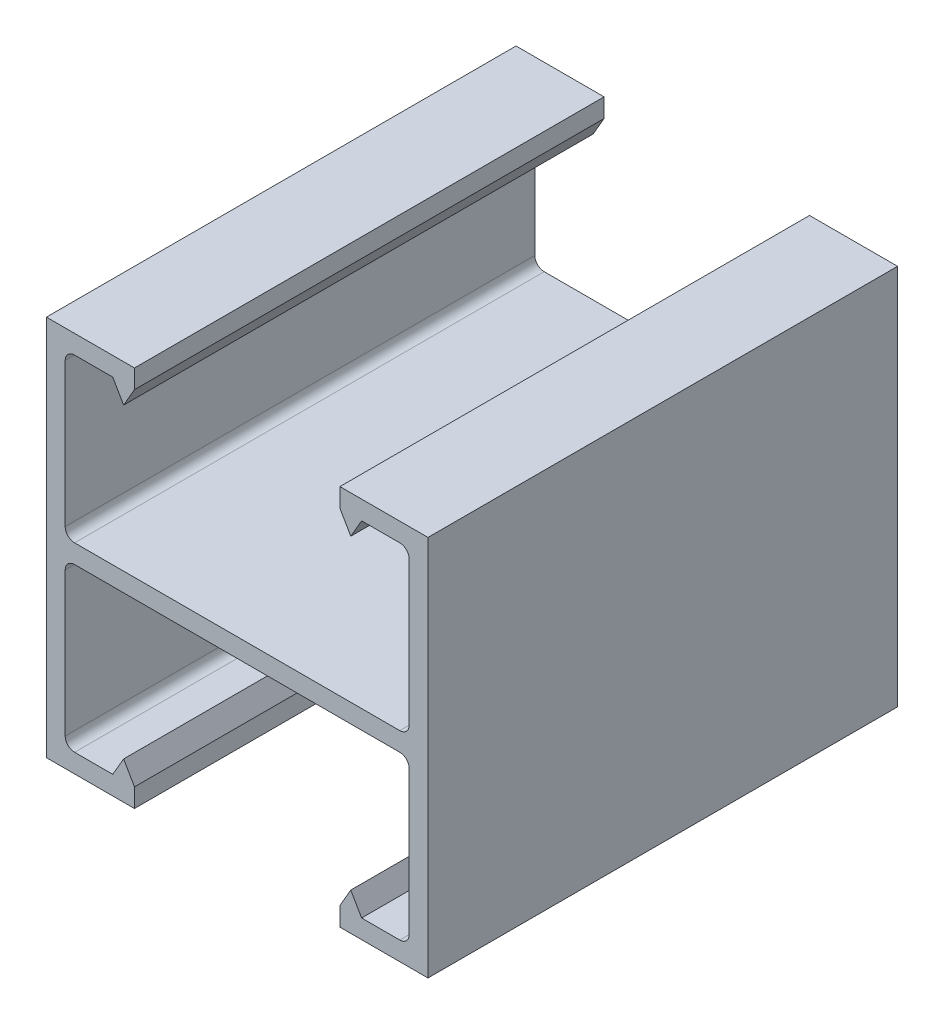
from build123d import *

# Parameters (mm, degrees)
BASE_EXTRUDE_DEPTH = 12.7


with BuildPart() as part:
    # Sketch1 → Base-Extrude (new, symmetric)
    with BuildSketch(Plane.XY):
        with BuildLine():
            Line((-5.55625, 10.31875), (-10.31875, 10.31875))
            Line((-10.31875, 10.31875), (-10.31875, -10.31875))
            Line((-10.31875, -10.31875), (-5.55625, -10.31875))
            Line((-5.55625, -10.31875), (-5.55625, -9.30275))
            Line((-5.55625, -9.30275), (-6.142837874, -8.28675))
            Line((-6.142837874, -8.28675), (-6.729425747, -9.30275))
            Line((-6.729425747, -9.30275), (-8.79475, -9.30275))
            ThreePointArc((-8.79475, -9.30275), (-9.153960245, -9.153960245), (-9.30275, -8.79475))
            Line((-9.30275, -8.79475), (-9.30275, -1.016))
            ThreePointArc((-9.30275, -1.016), (-9.153960245, -0.656789755), (-8.79475, -0.508))
            Line((-8.79475, -0.508), (8.79475, -0.508))
            ThreePointArc((8.79475, -0.508), (9.153960245, -0.656789755), (9.30275, -1.016))
            Line((9.30275, -1.016), (9.30275, -8.79475))
            ThreePointArc((9.30275, -8.79475), (9.153960245, -9.153960245), (8.79475, -9.30275))
            Line((8.79475, -9.30275), (6.729425747, -9.30275))
            Line((6.729425747, -9.30275), (6.142837874, -8.28675))
            Line((6.142837874, -8.28675), (5.55625, -9.30275))
            Line((5.55625, -9.30275), (5.55625, -10.31875))
            Line((5.55625, -10.31875), (10.31875, -10.31875))
            Line((10.31875, -10.31875), (10.31875, 10.31875))
            Line((10.31875, 10.31875), (5.55625, 10.31875))
            Line((5.55625, 10.31875), (5.55625, 9.30275))
            Line((5.55625, 9.30275), (6.142837874, 8.28675))
            Line((6.142837874, 8.28675), (6.729425747, 9.30275))
            Line((6.729425747, 9.30275), (8.79475, 9.30275))
            ThreePointArc((8.79475, 9.30275), (9.153960245, 9.153960245), (9.30275, 8.79475))
            Line((9.30275, 8.79475), (9.30275, 1.016))
            ThreePointArc((9.30275, 1.016), (9.153960245, 0.656789755), (8.79475, 0.508))
            Line((8.79475, 0.508), (-8.79475, 0.508))
            ThreePointArc((-8.79475, 0.508), (-9.153960245, 0.656789755), (-9.30275, 1.016))
            Line((-9.30275, 1.016), (-9.30275, 8.79475))
            ThreePointArc((-9.30275, 8.79475), (-9.153960245, 9.153960245), (-8.79475, 9.30275))
            Line((-8.79475, 9.30275), (-6.729425747, 9.30275))
            Line((-6.729425747, 9.30275), (-6.142837874, 8.28675))
            Line((-6.142837874, 8.28675), (-5.55625, 9.30275))
            Line((-5.55625, 9.30275), (-5.55625, 10.31875))
        make_face()
    extrude(amount=BASE_EXTRUDE_DEPTH, both=True)


solid = part.part
